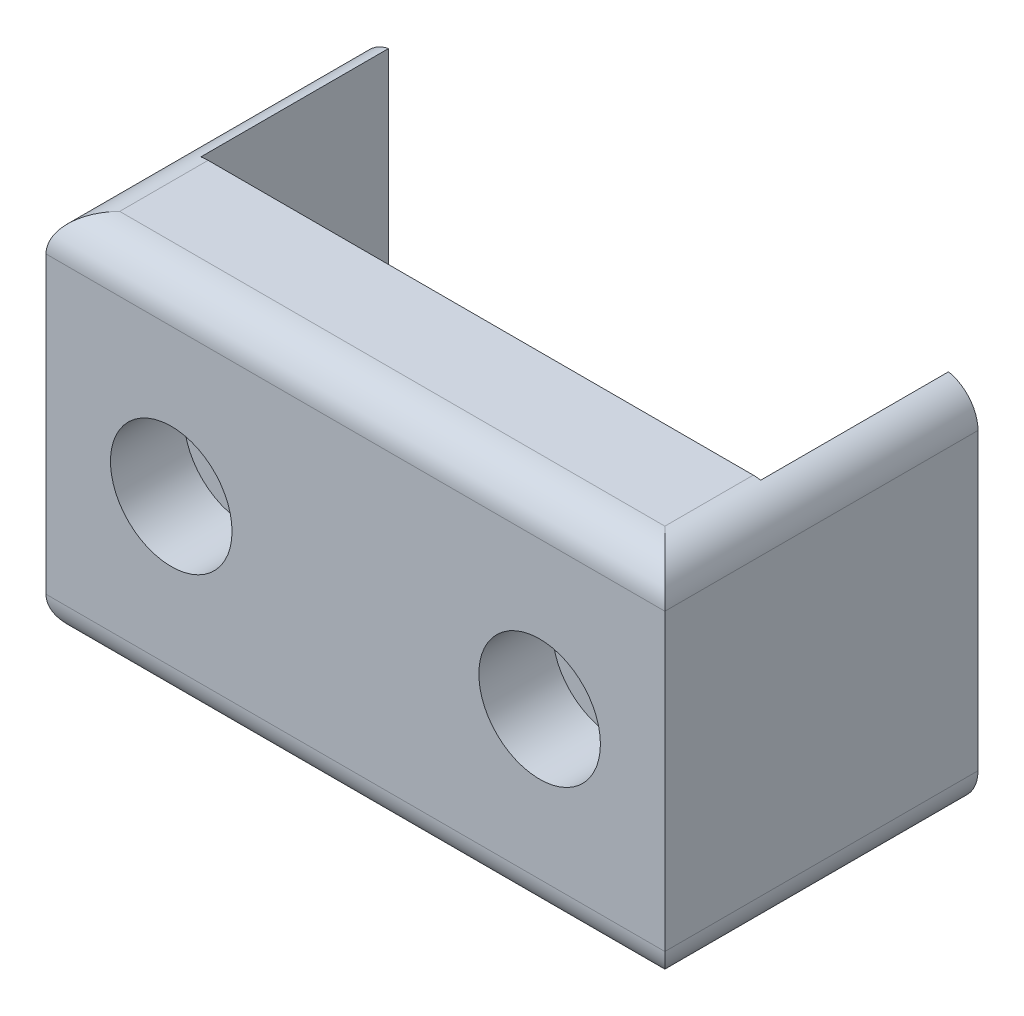
from build123d import *

# Parameters (mm, degrees)
BOSS_EXTRUDE1_DEPTH = 25.4
SKETCH2_R           = 2.54
CUT_EXTRUDE1_DEPTH  = 40.579199032
SKETCH3_R           = 4.191
CUT_EXTRUDE2_DEPTH  = 5.08
FILLET1_R           = 2.54
FILLET2_R           = 2.54


with BuildPart() as part:
    # Sketch1 → Boss-Extrude1 (new body)
    with BuildSketch(Plane(origin=(0, 0, 0), x_dir=(1, 0, 0), z_dir=(0, 1, 0))):
        Polygon((-19.304, 0), (-21.336, 0), (-21.336, -21.59), (21.336, -21.59), (21.336, 0), (19.304, 0), (19.304, -12.954), (-19.304, -12.954), align=None)
    extrude(amount=BOSS_EXTRUDE1_DEPTH)

    # Sketch2 → Cut-Extrude1 (cut, through all)
    with BuildSketch(Plane.XY.offset(21.59)):
        with Locations((-12.7, 12.7)):
            Circle(SKETCH2_R)
        with Locations((12.7, 12.7)):
            Circle(SKETCH2_R)
    extrude(amount=-CUT_EXTRUDE1_DEPTH, mode=Mode.SUBTRACT)

    # Sketch3 → Cut-Extrude2 (cut)
    with BuildSketch(Plane.XY.offset(21.59)):
        with Locations((-12.7, 12.7)):
            Circle(SKETCH3_R)
        with Locations((12.7, 12.7)):
            Circle(SKETCH3_R)
    extrude(amount=-CUT_EXTRUDE2_DEPTH, mode=Mode.SUBTRACT)

    # Fillet1
    fillet1_edges = [part.edges().sort_by_distance(p)[0] for p in [
        (-21.336, 25.4, 10.795),
        (21.336, 25.4, 10.795),
        (0, 25.4, 21.59),
    ]]
    fillet(fillet1_edges, radius=FILLET1_R)

    # Fillet2
    fillet2_edges = [part.edges().sort_by_distance(p)[0] for p in [
        (-21.336, 0, 10.795),
        (0, 0, 21.59),
        (21.336, 0, 10.795),
    ]]
    fillet(fillet2_edges, radius=FILLET2_R)


solid = part.part
